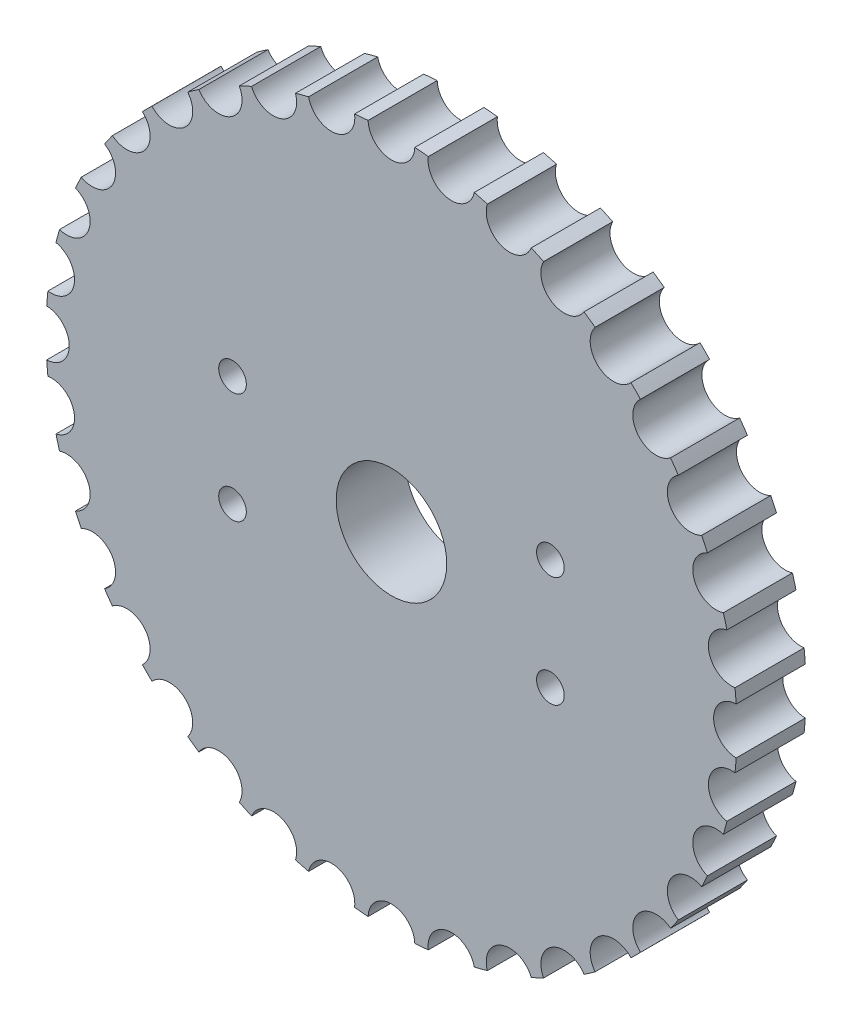
from build123d import *

# Parameters (mm, degrees)
SKETCH_1_R          = 50
EXTRUDE_1_DEPTH     = 10
SKETCH_4_R          = 8
CUT_EXTRUDE_3_DEPTH = 10
SKETCH_5_R          = 2
CUT_EXTRUDE_4_DEPTH = 10
SKETCH_6_R          = 3.38
CUT_EXTRUDE_5_DEPTH = 72.414284285


with BuildPart() as part:
    # 스케치1 → 보스-돌출1 (new body)
    with BuildSketch(Plane.XY):
        Circle(SKETCH_1_R)
    extrude(amount=EXTRUDE_1_DEPTH)

    # 스케치4 → 컷-돌출3 (cut)
    with BuildSketch(Plane.XY.offset(10)):
        Circle(SKETCH_4_R)
    extrude(amount=-CUT_EXTRUDE_3_DEPTH, mode=Mode.SUBTRACT)

    # 스케치5 → 컷-돌출4 (cut)
    with BuildSketch(Plane.XY.offset(10)):
        with Locations((-23, 8)):
            Circle(SKETCH_5_R)
        with Locations(Location((23, 8, 0), (0, 0, 180))):
            Circle(SKETCH_5_R)
        with Locations((23, -8)):
            Circle(SKETCH_5_R)
        with Locations(Location((-23, -8, 0), (0, 0, 180))):
            Circle(SKETCH_5_R)
    extrude(amount=-CUT_EXTRUDE_4_DEPTH, mode=Mode.SUBTRACT)

    # 스케치6 → 컷-돌출5 (cut, through all)
    with BuildSketch(Plane.XY.offset(10)):
        with Locations((0, 50)):
            Circle(SKETCH_6_R)
        with Locations((8.682408883, 49.240387651)):
            Circle(SKETCH_6_R)
        with Locations((17.101007166, 46.984631039)):
            Circle(SKETCH_6_R)
        with Locations((25, 43.301270189)):
            Circle(SKETCH_6_R)
        with Locations((32.139380484, 38.302222156)):
            Circle(SKETCH_6_R)
        with Locations((38.302222156, 32.139380484)):
            Circle(SKETCH_6_R)
        with Locations((43.301270189, 25)):
            Circle(SKETCH_6_R)
        with Locations((46.984631039, 17.101007166)):
            Circle(SKETCH_6_R)
        with Locations((49.240387651, 8.682408883)):
            Circle(SKETCH_6_R)
        with Locations((50, 0)):
            Circle(SKETCH_6_R)
        with Locations((49.240387651, -8.682408883)):
            Circle(SKETCH_6_R)
        with Locations((46.984631039, -17.101007166)):
            Circle(SKETCH_6_R)
        with Locations((43.301270189, -25)):
            Circle(SKETCH_6_R)
        with Locations((38.302222156, -32.139380484)):
            Circle(SKETCH_6_R)
        with Locations((32.139380484, -38.302222156)):
            Circle(SKETCH_6_R)
        with Locations((25, -43.301270189)):
            Circle(SKETCH_6_R)
        with Locations((17.101007166, -46.984631039)):
            Circle(SKETCH_6_R)
        with Locations((8.682408883, -49.240387651)):
            Circle(SKETCH_6_R)
        with Locations((0, -50)):
            Circle(SKETCH_6_R)
        with Locations((-8.682408883, -49.240387651)):
            Circle(SKETCH_6_R)
        with Locations((-17.101007166, -46.984631039)):
            Circle(SKETCH_6_R)
        with Locations((-25, -43.301270189)):
            Circle(SKETCH_6_R)
        with Locations((-32.139380484, -38.302222156)):
            Circle(SKETCH_6_R)
        with Locations((-38.302222156, -32.139380484)):
            Circle(SKETCH_6_R)
        with Locations((-43.301270189, -25)):
            Circle(SKETCH_6_R)
        with Locations((-46.984631039, -17.101007166)):
            Circle(SKETCH_6_R)
        with Locations((-49.240387651, -8.682408883)):
            Circle(SKETCH_6_R)
        with Locations((-50, 0)):
            Circle(SKETCH_6_R)
        with Locations((-49.240387651, 8.682408883)):
            Circle(SKETCH_6_R)
        with Locations((-46.984631039, 17.101007166)):
            Circle(SKETCH_6_R)
        with Locations((-43.301270189, 25)):
            Circle(SKETCH_6_R)
        with Locations((-38.302222156, 32.139380484)):
            Circle(SKETCH_6_R)
        with Locations((-32.139380484, 38.302222156)):
            Circle(SKETCH_6_R)
        with Locations((-25, 43.301270189)):
            Circle(SKETCH_6_R)
        with Locations((-17.101007166, 46.984631039)):
            Circle(SKETCH_6_R)
        with Locations((-8.682408883, 49.240387651)):
            Circle(SKETCH_6_R)
    extrude(amount=-CUT_EXTRUDE_5_DEPTH, mode=Mode.SUBTRACT)


solid = part.part
